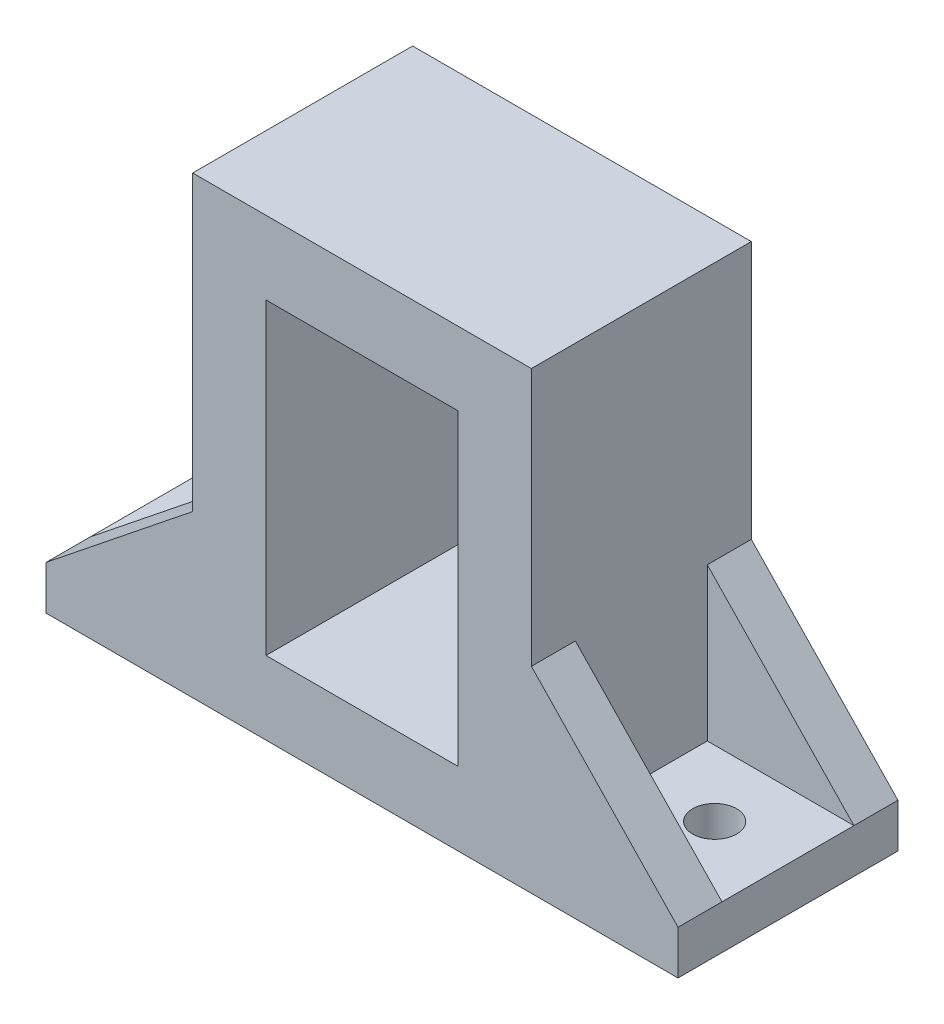
from build123d import *

# Parameters (mm, degrees)
ESBO_O1_W                = 13.1
ESBO_O1_H                = 21
RESSALTO_EXTRUS_O1_DEPTH = 15
ESBO_O2_W                = 15
ESBO_O2_H                = 3
RESSALTO_EXTRUS_O2_DEPTH = 10
ESBO_O3_W                = 3
ESBO_O3_H                = 8
RESSALTO_EXTRUS_O3_DEPTH = 10
CORTE_EXTRUS_O1_DEPTH    = 19
ESBO_O5_R                = 1.5
CORTE_EXTRUS_O2_DEPTH    = 19
RESSALTO_EXTRUS_O4_DEPTH = 10
CORTE_EXTRUS_O3_DEPTH    = 23
ESBO_O8_R                = 1.5
CORTE_EXTRUS_O4_DEPTH    = 23


with BuildPart() as part:
    # Esboço1 → Ressalto-extrusão1 (new body)
    with BuildSketch(Plane.XY):
        Polygon((0, 26), (5, 26), (5, -5), (-18.1, -5), (-18.1, 0), (-18.1, 26), align=None)
        with Locations((-6.55, 10.5)):
            Rectangle(ESBO_O1_W, ESBO_O1_H, mode=Mode.SUBTRACT)
    extrude(amount=RESSALTO_EXTRUS_O1_DEPTH)

    # Esboço2 → Ressalto-extrusão2 (add)
    with BuildSketch(Plane.ZY.offset(18.1)):
        with Locations((7.5, -3.5)):
            Rectangle(ESBO_O2_W, ESBO_O2_H)
    extrude(amount=RESSALTO_EXTRUS_O2_DEPTH)

    # Esboço3 → Ressalto-extrusão3 (add)
    with BuildSketch(Plane.ZY.offset(18.1)):
        with Locations((1.5, 2)):
            Rectangle(ESBO_O3_W, ESBO_O3_H)
        with Locations((13.5, 2)):
            Rectangle(ESBO_O3_W, ESBO_O3_H)
    extrude(amount=RESSALTO_EXTRUS_O3_DEPTH)

    # Esboço4 → Corte-extrusão1 (cut)
    with BuildSketch(Plane(origin=(0, 0, 0), x_dir=(-1, 0, 0), z_dir=(0, 0, -1))):
        Polygon((18.1, 6), (28.1, -2), (28.1, 6), align=None)
    extrude(amount=-CORTE_EXTRUS_O1_DEPTH, mode=Mode.SUBTRACT)

    # Esboço5 → Corte-extrusão2 (cut)
    with BuildSketch(Plane(origin=(0, -2, 0), x_dir=(1, 0, 0), z_dir=(0, 1, 0))):
        with Locations(Location((-23.1, -7.5, 0), (0, 0, 270))):
            Circle(ESBO_O5_R)
    extrude(amount=-CORTE_EXTRUS_O2_DEPTH, mode=Mode.SUBTRACT)

    # Esboço6 → Ressalto-extrusão4 (add)
    with BuildSketch(Plane(origin=(5, 0, 0), x_dir=(0, 0, -1), z_dir=(1, 0, 0))):
        Polygon((-15, -5), (-15, 8.409277905), (-12, 8.409277905), (-12, -2), (-3, -2), (-3, 8.409277905), (0, 8.409277905), (0, -5), align=None)
    extrude(amount=RESSALTO_EXTRUS_O4_DEPTH)

    # Esboço7 → Corte-extrusão3 (cut)
    with BuildSketch(Plane(origin=(0, 0, 0), x_dir=(-1, 0, 0), z_dir=(0, 0, -1))):
        Polygon((-5, 8.409277905), (-15, -2), (-15, 8.409277905), align=None)
    extrude(amount=-CORTE_EXTRUS_O3_DEPTH, mode=Mode.SUBTRACT)

    # Esboço8 → Corte-extrusão4 (cut)
    with BuildSketch(Plane(origin=(0, -2, 0), x_dir=(1, 0, 0), z_dir=(0, 1, 0))):
        with Locations(Location((10, -7.5, 0), (0, 0, 270))):
            Circle(ESBO_O8_R)
    extrude(amount=-CORTE_EXTRUS_O4_DEPTH, mode=Mode.SUBTRACT)


solid = part.part
